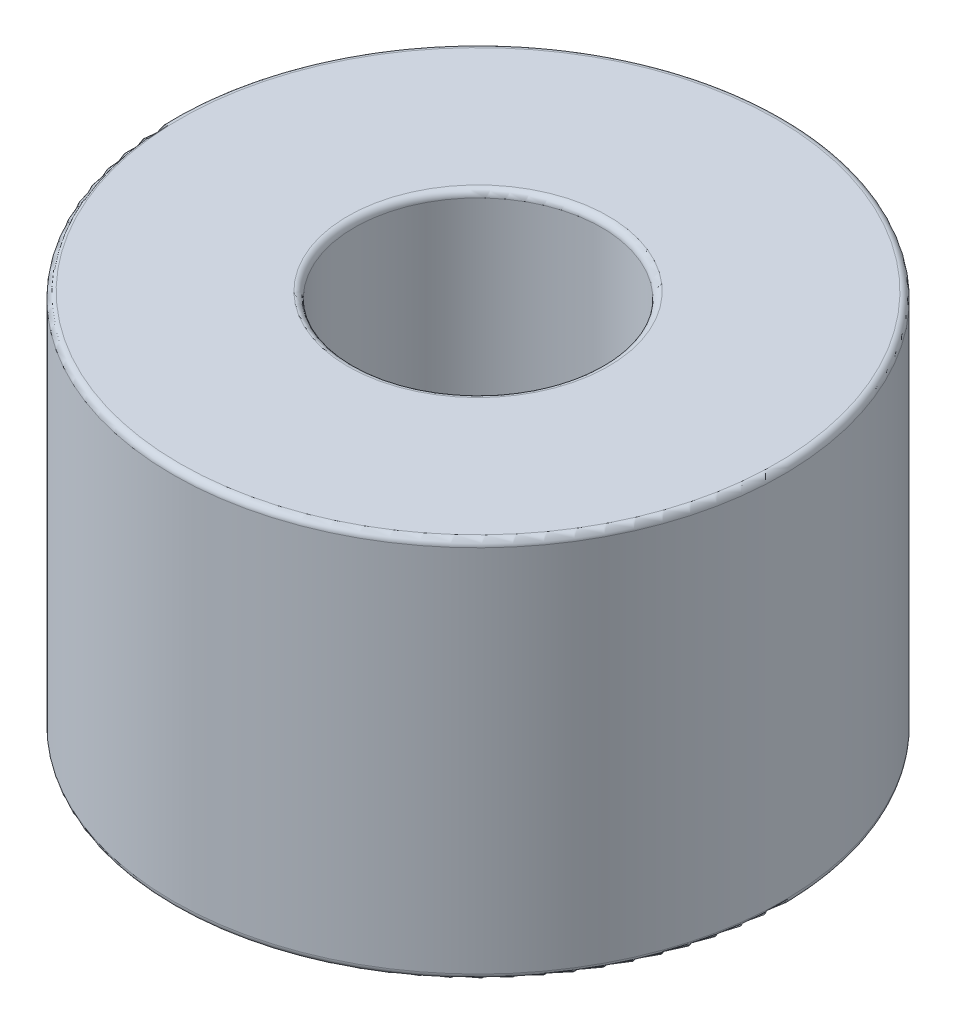
from build123d import *

# Parameters (mm, degrees)
SKETCH1_R           = 11.75
SKETCH1_R_2         = 4.765
BOSS_EXTRUDE1_DEPTH = 14.732
FILLET1_R           = 0.254


with BuildPart() as part:
    # Sketch1 → Boss-Extrude1 (new body)
    with BuildSketch(Plane(origin=(0, 0, 0), x_dir=(1, 0, 0), z_dir=(0, 1, 0))):
        with Locations(Location((0, 0, 0), (0, 0, 270))):
            Circle(SKETCH1_R)
        with Locations(Location((0, 0, 0), (0, 0, 270))):
            Circle(SKETCH1_R_2, mode=Mode.SUBTRACT)
    extrude(amount=BOSS_EXTRUDE1_DEPTH)

    # Fillet1
    fillet1_edges = [part.edges().sort_by_distance(p)[0] for p in [
        (0, 0, -11.75),
        (0, 14.732, -11.75),
        (0, 0, -4.765),
        (0, 14.732, -4.765),
    ]]
    fillet(fillet1_edges, radius=FILLET1_R)


solid = part.part
